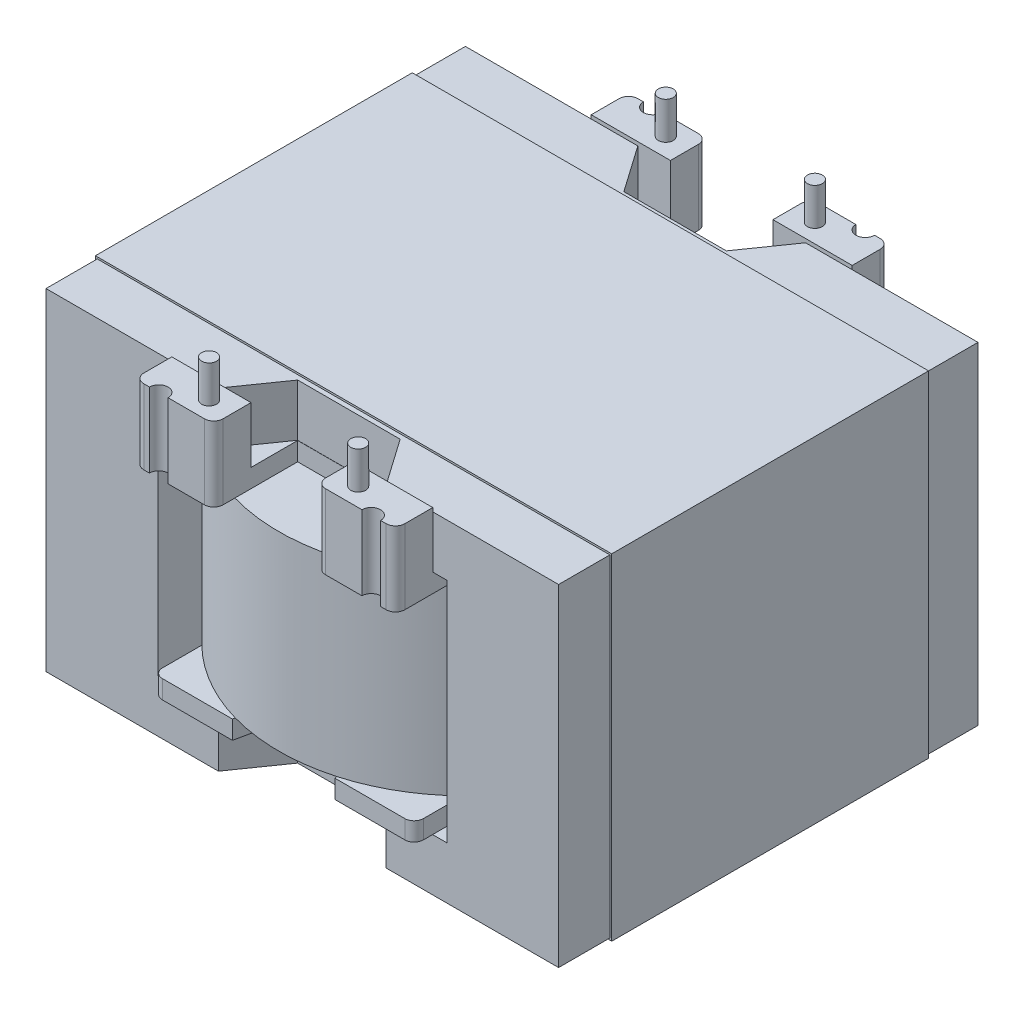
from build123d import *

# Parameters (mm, degrees)
SKETCH_1_W               = 27.5
SKETCH_1_H               = 22.5
EXTRUDE_1_DEPTH          = 17.8
CUT_EXTRUDE_1_DEPTH      = 26.148856833
CUT_EXTRUDE_1_DEPTH_BACK = 26.148856833
SKETCH_3_W               = 15.5
SKETCH_3_H               = 12.2
CUT_EXTRUDE_2_DEPTH      = 26.148856833
EXTRUDE_2_DEPTH          = 5.1
EXTRUDE_2_DEPTH_BACK     = 5.1
EXTRUDE_3_DEPTH          = 0.99
EXTRUDE_4_DEPTH          = 0.99
EXTRUDE_5_DEPTH          = 3.01
SKETCH_8_R               = 0.4
EXTRUDE_6_DEPTH          = 2
SKETCH_9_W               = 27.7
SKETCH_9_H               = 18
SKETCH_9_W_2             = 27.5
SKETCH_9_H_2             = 17.8
EXTRUDE_7_DEPTH          = 8.5


with BuildPart() as part:
    # Эскиз1 → Бобышка-Вытянуть1 (new body)
    with BuildSketch(Plane(origin=(0, 0, 0), x_dir=(1, 0, 0), z_dir=(0, 1, 0))):
        Rectangle(SKETCH_1_W, SKETCH_1_H)
    extrude(amount=EXTRUDE_1_DEPTH)

    # Эскиз3 → Вырез-Вытянуть1 (cut, two sides: drawn at the far end of the back side and taken through both)
    with BuildSketch(Plane.XY.offset(-CUT_EXTRUDE_1_DEPTH_BACK)):
        with Locations((0, 8.9)):
            Rectangle(SKETCH_3_W, SKETCH_3_H)
    extrude(amount=CUT_EXTRUDE_1_DEPTH + CUT_EXTRUDE_1_DEPTH_BACK, mode=Mode.SUBTRACT)

    # Эскиз4 → Вырез-Вытянуть2 (cut, through all)
    with BuildSketch(Plane(origin=(0, 0, 0), x_dir=(1, 0, 0), z_dir=(0, 1, 0))):
        Polygon((-4.5, 11.25), (-2.75, 8.75), (2.75, 8.75), (4.5, 11.25), align=None)
        Polygon((4.5, -11.25), (-4.5, -11.25), (-2.75, -8.75), (2.75, -8.75), align=None)
    extrude(amount=CUT_EXTRUDE_2_DEPTH, mode=Mode.SUBTRACT)

    # Эскиз2 → Бобышка-Вытянуть2 (add, two sides: drawn at the far end of the back side and taken through both)
    with BuildSketch(Plane(origin=(0, 8.9, 0), x_dir=(1, 0, 0), z_dir=(0, 1, 0)).offset(-EXTRUDE_2_DEPTH_BACK)):
        with BuildLine():
            Line((-10, -2.5), (-10, 2.5))
            ThreePointArc((-10, 2.5), (0, 12.5), (10, 2.5))
            Line((10, 2.5), (10, -2.5))
            ThreePointArc((10, -2.5), (0, -12.5), (-10, -2.5))
        make_face()
    extrude(amount=EXTRUDE_2_DEPTH + EXTRUDE_2_DEPTH_BACK)

    # Эскиз5 → Бобышка-Вытянуть3 (add)
    with BuildSketch(Plane.XZ.offset(-3.8)):
        with BuildLine():
            Line((7, 11.75), (7, -11.75))
            ThreePointArc((7, -11.75), (6.853553391, -12.103553391), (6.5, -12.25))
            Line((6.5, -12.25), (2.75, -12.25))
            Line((2.75, -12.25), (2.084693312, -9.145235456))
            ThreePointArc((2.084693312, -9.145235456), (1.910130877, -8.861166956), (1.595792105, -8.75))
            Line((1.595792105, -8.75), (-1.595792105, -8.75))
            ThreePointArc((-1.595792105, -8.75), (-1.910130877, -8.861166956), (-2.084693312, -9.145235456))
            Line((-2.084693312, -9.145235456), (-2.75, -12.25))
            Line((-2.75, -12.25), (-6.5, -12.25))
            ThreePointArc((-6.5, -12.25), (-6.853553391, -12.103553391), (-7, -11.75))
            Line((-7, -11.75), (-7, 11.75))
            ThreePointArc((-7, 11.75), (-6.853553391, 12.103553391), (-6.5, 12.25))
            Line((-6.5, 12.25), (-2.75, 12.25))
            Line((-2.75, 12.25), (-2.084693312, 9.145235456))
            ThreePointArc((-2.084693312, 9.145235456), (-1.910130877, 8.861166956), (-1.595792105, 8.75))
            Line((-1.595792105, 8.75), (1.595792105, 8.75))
            ThreePointArc((1.595792105, 8.75), (1.910130877, 8.861166956), (2.084693312, 9.145235456))
            Line((2.084693312, 9.145235456), (2.75, 12.25))
            Line((2.75, 12.25), (6.5, 12.25))
            ThreePointArc((6.5, 12.25), (6.853553391, 12.103553391), (7, 11.75))
        make_face()
    extrude(amount=EXTRUDE_3_DEPTH)

    # Эскиз6 → Бобышка-Вытянуть4 (add)
    with BuildSketch(Plane(origin=(0, 14, 0), x_dir=(1, 0, 0), z_dir=(0, 1, 0))):
        with BuildLine():
            Line((-7, -12.75), (-7, 12.75))
            ThreePointArc((-7, 12.75), (-6.853553391, 13.103553391), (-6.5, 13.25))
            Line((-6.5, 13.25), (-6.2, 13.25))
            ThreePointArc((-6.2, 13.25), (-5.7, 12.75), (-5.2, 13.25))
            Line((-5.2, 13.25), (-3.25, 13.25))
            ThreePointArc((-3.25, 13.25), (-2.896446609, 13.103553391), (-2.75, 12.75))
            Line((-2.75, 12.75), (-2.75, 8.75))
            Line((-2.75, 8.75), (2.75, 8.75))
            Line((2.75, 8.75), (2.75, 12.75))
            ThreePointArc((2.75, 12.75), (2.896446609, 13.103553391), (3.25, 13.25))
            Line((3.25, 13.25), (5.2, 13.25))
            ThreePointArc((5.2, 13.25), (5.7, 12.75), (6.2, 13.25))
            Line((6.2, 13.25), (6.5, 13.25))
            ThreePointArc((6.5, 13.25), (6.853553391, 13.103553391), (7, 12.75))
            Line((7, 12.75), (7, -12.75))
            ThreePointArc((7, -12.75), (6.853553391, -13.103553391), (6.5, -13.25))
            Line((6.5, -13.25), (6.2, -13.25))
            ThreePointArc((6.2, -13.25), (5.7, -12.75), (5.2, -13.25))
            Line((5.2, -13.25), (3.25, -13.25))
            ThreePointArc((3.25, -13.25), (2.896446609, -13.103553391), (2.75, -12.75))
            Line((2.75, -12.75), (2.75, -8.75))
            Line((2.75, -8.75), (-2.75, -8.75))
            Line((-2.75, -8.75), (-2.75, -12.75))
            ThreePointArc((-2.75, -12.75), (-2.896446609, -13.103553391), (-3.25, -13.25))
            Line((-3.25, -13.25), (-5.2, -13.25))
            ThreePointArc((-5.2, -13.25), (-5.7, -12.75), (-6.2, -13.25))
            Line((-6.2, -13.25), (-6.5, -13.25))
            ThreePointArc((-6.5, -13.25), (-6.853553391, -13.103553391), (-7, -12.75))
        make_face()
    extrude(amount=EXTRUDE_4_DEPTH)

    # Эскиз7 → Бобышка-Вытянуть5 (add)
    with BuildSketch(Plane(origin=(0, 14.99, 0), x_dir=(1, 0, 0), z_dir=(0, 1, 0))):
        with BuildLine():
            Line((-7, 11.25), (-2.75, 11.25))
            Line((-2.75, 11.25), (-2.75, 12.75))
            ThreePointArc((-2.75, 12.75), (-2.896446609, 13.103553391), (-3.25, 13.25))
            Line((-3.25, 13.25), (-5.2, 13.25))
            ThreePointArc((-5.2, 13.25), (-5.7, 12.75), (-6.2, 13.25))
            Line((-6.2, 13.25), (-6.5, 13.25))
            ThreePointArc((-6.5, 13.25), (-6.853553391, 13.103553391), (-7, 12.75))
            Line((-7, 12.75), (-7, 11.25))
        make_face()
        with BuildLine():
            Line((7, 11.25), (2.75, 11.25))
            Line((2.75, 11.25), (2.75, 12.75))
            ThreePointArc((2.75, 12.75), (2.896446609, 13.103553391), (3.25, 13.25))
            Line((3.25, 13.25), (5.2, 13.25))
            ThreePointArc((5.2, 13.25), (5.7, 12.75), (6.2, 13.25))
            Line((6.2, 13.25), (6.5, 13.25))
            ThreePointArc((6.5, 13.25), (6.853553391, 13.103553391), (7, 12.75))
            Line((7, 12.75), (7, 11.25))
        make_face()
        with BuildLine():
            Line((7, -11.25), (2.75, -11.25))
            Line((2.75, -11.25), (2.75, -12.75))
            ThreePointArc((2.75, -12.75), (2.896446609, -13.103553391), (3.25, -13.25))
            Line((3.25, -13.25), (5.2, -13.25))
            ThreePointArc((5.2, -13.25), (5.7, -12.75), (6.2, -13.25))
            Line((6.2, -13.25), (6.5, -13.25))
            ThreePointArc((6.5, -13.25), (6.853553391, -13.103553391), (7, -12.75))
            Line((7, -12.75), (7, -11.25))
        make_face()
        with BuildLine():
            Line((-7, -11.25), (-2.75, -11.25))
            Line((-2.75, -11.25), (-2.75, -12.75))
            ThreePointArc((-2.75, -12.75), (-2.896446609, -13.103553391), (-3.25, -13.25))
            Line((-3.25, -13.25), (-5.2, -13.25))
            ThreePointArc((-5.2, -13.25), (-5.7, -12.75), (-6.2, -13.25))
            Line((-6.2, -13.25), (-6.5, -13.25))
            ThreePointArc((-6.5, -13.25), (-6.853553391, -13.103553391), (-7, -12.75))
            Line((-7, -12.75), (-7, -11.25))
        make_face()
    extrude(amount=EXTRUDE_5_DEPTH)

    # Эскиз8 → Бобышка-Вытянуть6 (add)
    with BuildSketch(Plane(origin=(0, 18, 0), x_dir=(1, 0, 0), z_dir=(0, 1, 0))):
        with Locations(Location((4, -12.25, 0), (0, 0, 90))):
            Circle(SKETCH_8_R)
        with Locations(Location((-4, -12.25, 0), (0, 0, 90))):
            Circle(SKETCH_8_R)
        with Locations(Location((-4, 12.25, 0), (0, 0, 90))):
            Circle(SKETCH_8_R)
        with Locations(Location((4, 12.25, 0), (0, 0, 90))):
            Circle(SKETCH_8_R)
    extrude(amount=EXTRUDE_6_DEPTH)

    # Эскиз9 → Бобышка-Вытянуть7 (add, symmetric)
    with BuildSketch(Plane.XY):
        with Locations((0, 8.9)):
            Rectangle(SKETCH_9_W, SKETCH_9_H)
        with Locations((0, 8.9)):
            Rectangle(SKETCH_9_W_2, SKETCH_9_H_2, mode=Mode.SUBTRACT)
    extrude(amount=EXTRUDE_7_DEPTH, both=True)


solid = part.part
